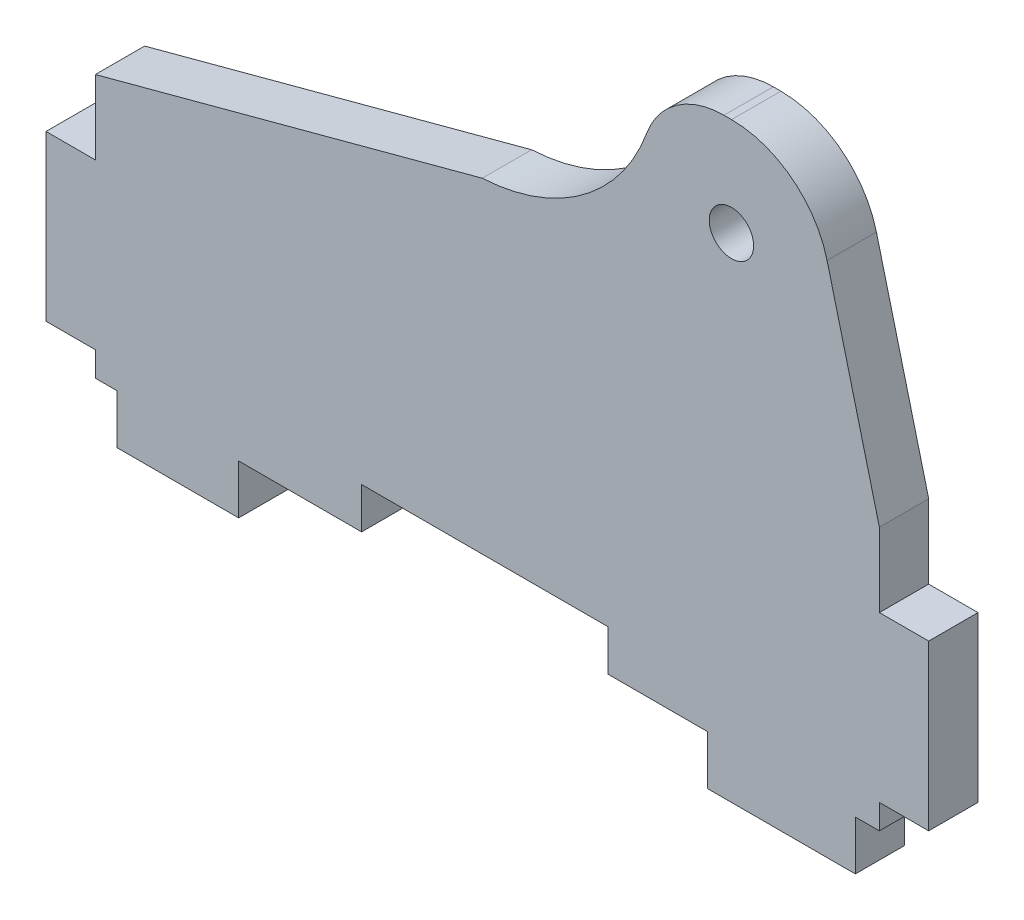
from build123d import *

# Parameters (mm, degrees)
SKETCH_1_R      = 1.35
EXTRUDE_1_DEPTH = 3


with BuildPart() as part:
    # 草图1 → 凸台-拉伸1 (new body)
    with BuildSketch(Plane(origin=(0, 0, 0), x_dir=(-1, 0, 0), z_dir=(0, 0, -1))):
        with BuildLine():
            Line((-47.519320255, 26.959319012), (-50.6992, 14.4996))
            Line((-50.6992, 14.4996), (-50.6992, 10.0003))
            Line((-50.6992, 10.0003), (-53.6992, 10.0003))
            Line((-53.6992, 10.0003), (-53.6992, 0))
            Line((-53.6992, 0), (-50.6992, 0))
            Line((-50.6992, 0), (-50.6992, -1.5007))
            Line((-50.6992, -1.5007), (-49.2382, -1.5007))
            Line((-49.2382, -1.5007), (-49.2382, -4.5007))
            Line((-49.2382, -4.5007), (-40.2392, -4.5007))
            Line((-40.2392, -4.5007), (-40.2392, -1.4993))
            Line((-40.2392, -1.4993), (-34.2002, -1.4993))
            Line((-34.2002, -1.4993), (-34.2002, 1.0005))
            Line((-34.2002, 1.0005), (-19.2003, 1.0005))
            Line((-19.2003, 1.0005), (-19.2003, -1.4993))
            Line((-19.2003, -1.4993), (-11.7217, -1.4993))
            Line((-11.7217, -1.4993), (-11.7217, -4.5007))
            Line((-11.7217, -4.5007), (-4.3215, -4.5007))
            Line((-4.3215, -4.5007), (-4.3215, -1.5007))
            Line((-4.3215, -1.5007), (-3, -1.5007))
            Line((-3, -1.5007), (-3, 0))
            Line((-3, 0), (0, 0))
            Line((0, 0), (0, 10.0003))
            Line((0, 10.0003), (-3, 10.0003))
            Line((-3, 10.0003), (-3, 14.4996))
            Line((-3, 14.4996), (-26.543543046, 20.807804388))
            ThreePointArc((-26.543543046, 20.807804388), (-32.65852857, 22.990550509), (-36.548909006, 28.188854909))
            ThreePointArc((-36.548909006, 28.188854909), (-38.379715818, 30.572322748), (-41.246222879, 31.4756))
            Line((-41.246222879, 31.4756), (-41.70566582, 31.4756))
            ThreePointArc((-41.70566582, 31.4756), (-45.386541118, 30.213865193), (-47.519320255, 26.959319012))
        make_face()
        with Locations(Location((-41.6992, 25.49975, 0), (0, 0, 180))):
            Circle(SKETCH_1_R, mode=Mode.SUBTRACT)
    extrude(amount=-EXTRUDE_1_DEPTH)


solid = part.part
